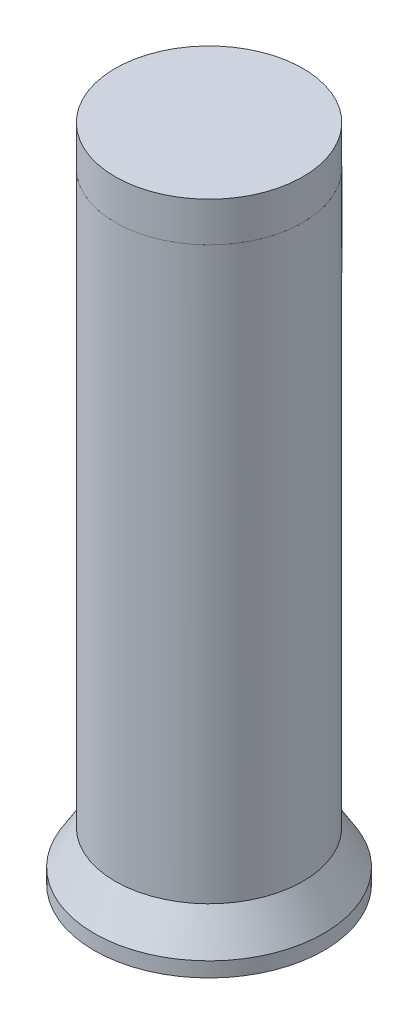
from build123d import *

# Parameters (mm, degrees)
SKETCH_2_R          = 31.5
CUT_EXTRUDE_1_DEPTH = 288.463475941
SKETCH_3_R          = 34
CUT_EXTRUDE_2_DEPTH = 9
SKETCH_4_W          = 90.880259592
SKETCH_4_H          = 24.111111111
CUT_EXTRUDE_3_DEPTH = 50
SKETCH_5_R          = 38
EXTRUDE_1_DEPTH     = 16


with BuildPart() as part:
    # 草圖1 → 旋轉1 (revolve)
    with BuildSketch(Plane.XY, mode=Mode.PRIVATE) as revolve_1_sk:
        Polygon((0, 0), (0, 6), (8.5, 20), (8.5, 268), (46.5, 268), (46.5, 0), align=None)
    revolve(revolve_1_sk.sketch.rotate(Axis((46.5, 292.214178218, 0), (0, -1, 0)), 270), axis=Axis((46.5, 292.214178218, 0), (0, -1, 0)))

    # 草圖2 → 除料-伸長1 (cut, through all)
    with BuildSketch(Plane(origin=(0, 268, 0), x_dir=(1, 0, 0), z_dir=(0, 1, 0))):
        with Locations(Location((46.5, 0, 0), (0, 0, 270))):
            Circle(SKETCH_2_R)
    extrude(amount=-CUT_EXTRUDE_1_DEPTH, mode=Mode.SUBTRACT)

    # 草圖3 → 除料-伸長2 (cut)
    with BuildSketch(Plane.XZ):
        with Locations(Location((46.5, 0, 0), (0, 0, 270))):
            Circle(SKETCH_3_R)
    extrude(amount=-CUT_EXTRUDE_2_DEPTH, mode=Mode.SUBTRACT)

    # 草圖4 → 除料-伸長3 (cut, symmetric)
    with BuildSketch(Plane.XY):
        with Locations((45.440129796, 263.055555556)):
            Rectangle(SKETCH_4_W, SKETCH_4_H)
    extrude(amount=CUT_EXTRUDE_3_DEPTH, both=True, mode=Mode.SUBTRACT)


with BuildPart() as body_2:
    # 草圖5 → 填料-伸長1 (new body)
    with BuildSketch(Plane(origin=(0, 251, 0), x_dir=(1, 0, 0), z_dir=(0, 1, 0))):
        with Locations(Location((46.5, 0, 0), (0, 0, 270))):
            Circle(SKETCH_5_R)
    extrude(amount=EXTRUDE_1_DEPTH)


solid = Compound([part.part, body_2.part])
